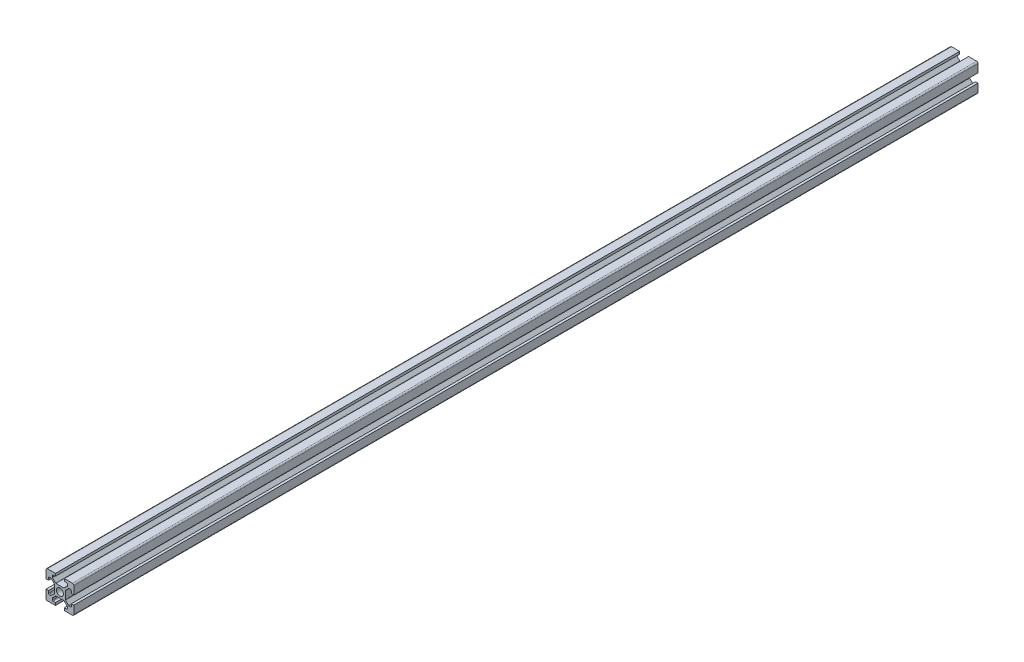
from build123d import *

# Parameters (mm, degrees)
SKETCH1_R               = 2.5
BOSS_EXTRUDE1_DEPTH     = 650
FILLET1_R               = 1
FILLET2_R               = 0.5
FILLET3_R               = 0.5
FILLET4_R               = 0.5
FILLET5_R               = 0.5
CUT_EXTRUDE1_DEPTH      = 651.615093585
CUT_EXTRUDE1_DEPTH_BACK = 651.615093585
SKETCH2_R               = 2.5
CUT_EXTRUDE2_DEPTH      = 651.615093585
CUT_EXTRUDE2_DEPTH_BACK = 651.615093585
SKETCH3_R               = 2.5


with BuildPart() as part:
    # Sketch1 → Boss-Extrude1 (new body)
    with BuildSketch(Plane.XY):
        Polygon((13.2, 0), (13.2, 1.8), (15.45, 1.8), (15.45, 3.6), (12.95, 6.1), (7.05, 6.1), (4.55, 3.6), (4.55, 1.8), (6.8, 1.8), (6.8, 0), (0, 0), (0, 6.8), (1.8, 6.8), (1.8, 4.55), (3.6, 4.55), (6.1, 7.05), (6.1, 12.95), (3.6, 15.45), (1.8, 15.45), (1.8, 13.2), (0, 13.2), (0, 20), (6.8, 20), (6.8, 18.2), (4.55, 18.2), (4.55, 16.4), (7.05, 13.9), (12.95, 13.9), (15.45, 16.4), (15.45, 18.2), (13.2, 18.2), (13.2, 20), (20, 20), (20, 13.2), (18.2, 13.2), (18.2, 15.45), (16.4, 15.45), (13.9, 12.95), (13.9, 7.05), (16.4, 4.55), (18.2, 4.55), (18.2, 6.8), (20, 6.8), (20, 0), align=None)
        with Locations((10, 10)):
            Circle(SKETCH1_R, mode=Mode.SUBTRACT)
    extrude(amount=BOSS_EXTRUDE1_DEPTH)

    # Fillet1
    fillet1_edges = [part.edges().sort_by_distance(p)[0] for p in [
        (0, 0, 325),
        (0, 20, 325),
        (20, 20, 325),
        (20, 0, 325),
    ]]
    fillet(fillet1_edges, radius=FILLET1_R)

    # Fillet2
    fillet2_edges = [part.edges().sort_by_distance(p)[0] for p in [
        (4.55, 18.2, 325),
        (4.55, 16.4, 325),
        (7.05, 13.9, 325),
        (12.95, 13.9, 325),
        (15.45, 16.4, 325),
        (15.45, 18.2, 325),
    ]]
    fillet(fillet2_edges, radius=FILLET2_R)

    # Fillet3
    fillet3_edges = [part.edges().sort_by_distance(p)[0] for p in [
        (18.2, 15.45, 325),
        (16.4, 15.45, 325),
        (13.9, 12.95, 325),
        (13.9, 7.05, 325),
        (16.4, 4.55, 325),
        (18.2, 4.55, 325),
    ]]
    fillet(fillet3_edges, radius=FILLET3_R)

    # Fillet4
    fillet4_edges = [part.edges().sort_by_distance(p)[0] for p in [
        (1.8, 4.55, 325),
        (3.6, 4.55, 325),
        (6.1, 7.05, 325),
        (6.1, 12.95, 325),
        (3.6, 15.45, 325),
        (1.8, 15.45, 325),
    ]]
    fillet(fillet4_edges, radius=FILLET4_R)

    # Fillet5
    fillet5_edges = [part.edges().sort_by_distance(p)[0] for p in [
        (15.45, 1.8, 325),
        (15.45, 3.6, 325),
        (12.95, 6.1, 325),
        (7.05, 6.1, 325),
        (4.55, 3.6, 325),
        (4.55, 1.8, 325),
    ]]
    fillet(fillet5_edges, radius=FILLET5_R)

    # Sketch2 → Cut-Extrude1 (cut, two sides: drawn at the far end of the back side and taken through both)
    with BuildSketch(Plane(origin=(0, 0, 0), x_dir=(0, 0, -1), z_dir=(1, 0, 0)).offset(-CUT_EXTRUDE1_DEPTH_BACK)):
        with Locations(Location((-614.75, 10, 0), (0, 0, 270))):
            Circle(SKETCH2_R)
        with Locations(Location((-35.25, 10, 0), (0, 0, 270))):
            Circle(SKETCH2_R)
    extrude(amount=CUT_EXTRUDE1_DEPTH + CUT_EXTRUDE1_DEPTH_BACK, mode=Mode.SUBTRACT)

    # Sketch3 → Cut-Extrude2 (cut, two sides: drawn at the far end of the back side and taken through both)
    with BuildSketch(Plane(origin=(0, 0, 0), x_dir=(1, 0, 0), z_dir=(0, 1, 0)).offset(-CUT_EXTRUDE2_DEPTH_BACK)):
        with Locations(Location((10, -615, 0), (0, 0, 90))):
            Circle(SKETCH3_R)
        with Locations(Location((10, -35, 0), (0, 0, 139.054791067))):
            Circle(SKETCH3_R)
    extrude(amount=CUT_EXTRUDE2_DEPTH + CUT_EXTRUDE2_DEPTH_BACK, mode=Mode.SUBTRACT)


solid = part.part
